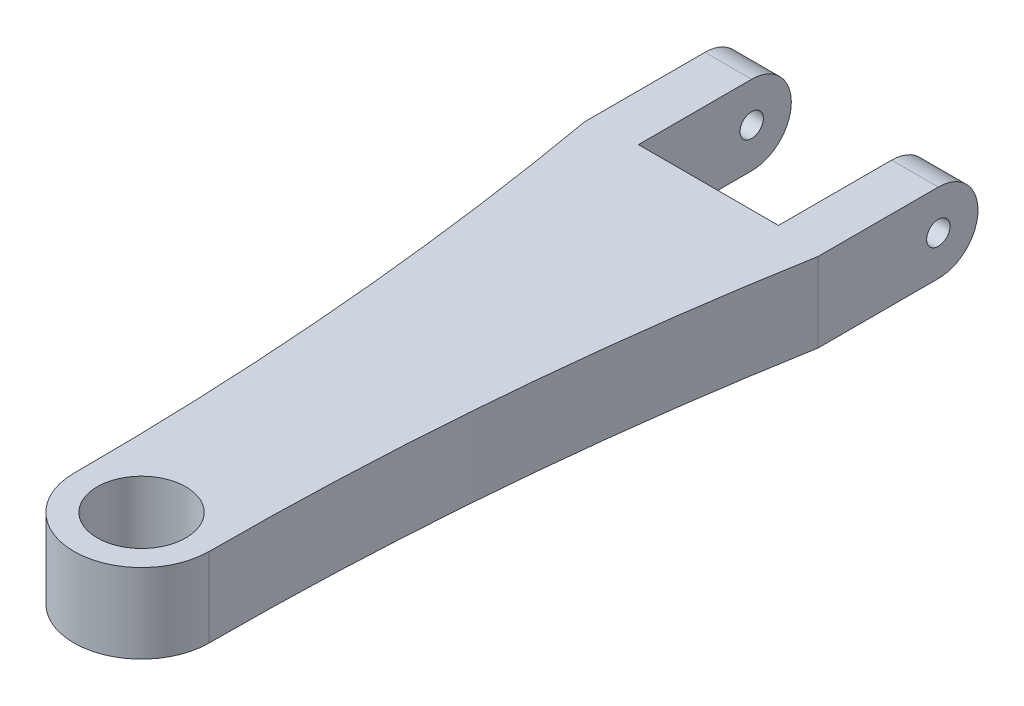
from build123d import *

# Parameters (mm, degrees)
SKETCH1_R               = 12.065
BOSS_EXTRUDE1_DEPTH     = 10.795
SKETCH5_W               = 38.1
SKETCH5_H               = 21.59
BOSS_EXTRUDE2_DEPTH     = 101.6
CUT_EXTRUDE1_REACH      = 261.255
SKETCH6_R               = 3.175
SKETCH4_W               = 12.7
SKETCH4_H               = 21.59
BOSS_EXTRUDE3_DEPTH     = 50.8
CUT_EXTRUDE2_DEPTH      = 210.73176208
CUT_EXTRUDE2_DEPTH_BACK = 210.73176208
SKETCH6_2_R             = 3.175
CUT_EXTRUDE3_DEPTH      = 214.164307578
CUT_EXTRUDE3_DEPTH_BACK = 214.164307578


with BuildPart() as part:
    # Sketch1 → Boss-Extrude1 (new, symmetric)
    with BuildSketch(Plane(origin=(0, 0, 0), x_dir=(1, 0, 0), z_dir=(0, 1, 0))):
        with BuildLine():
            Line((-31.75, 152.4), (31.75, 152.4))
            ThreePointArc((31.75, 152.4), (21.755106695, 76.491146914), (18.415, 0))
            ThreePointArc((18.415, 0), (0, -18.415), (-18.415, 0))
            ThreePointArc((-18.415, 0), (-21.755106695, 76.491146914), (-31.75, 152.4))
        make_face()
        Circle(SKETCH1_R, mode=Mode.SUBTRACT)
    extrude(amount=BOSS_EXTRUDE1_DEPTH, both=True)

    # Sketch5 → Boss-Extrude2 (add)
    with BuildSketch(Plane(origin=(0, 0, -152.4), x_dir=(-1, 0, 0), z_dir=(0, 0, -1))):
        Rectangle(SKETCH5_W, SKETCH5_H)
    extrude(amount=BOSS_EXTRUDE2_DEPTH)

    # Sketch6 → Cut-Extrude1 (cut, up to next)
    with BuildSketch(Plane(origin=(19.05, 0, 0), x_dir=(0, 0, -1), z_dir=(1, 0, 0)), mode=Mode.PRIVATE) as cut_extrude1_sk1:
        Polygon((152.4, -10.795), (154.288880246, 10.795), (254, 10.795), (254, -10.795), align=None)
        with Locations((185.094440123, 0)):
            Circle(SKETCH6_R, mode=Mode.SUBTRACT)
    cut_extrude1_tool1 = extrude(cut_extrude1_sk1.sketch, amount=-CUT_EXTRUDE1_REACH, mode=Mode.PRIVATE) & part.part
    add(cut_extrude1_tool1.solids().sort_by_distance((19.05, -0.034262, -203.945458))[0], mode=Mode.SUBTRACT)


with BuildPart() as cut_extrude1_piece_1:
    # of the separate pieces the step leaves, piece 1, a body of its own (cut_extrude1_pieces)
    add(part.part.solids().sort_by_distance((-31.75, -10.795, -152.4))[0])

    # Sketch4 → Boss-Extrude3 (add)
    with BuildSketch(Plane(origin=(0, 0, -152.4), x_dir=(-1, 0, 0), z_dir=(0, 0, -1))):
        with Locations((-25.4, 0)):
            Rectangle(SKETCH4_W, SKETCH4_H)
        with Locations((25.4, 0)):
            Rectangle(SKETCH4_W, SKETCH4_H)
    extrude(amount=BOSS_EXTRUDE3_DEPTH)


with BuildPart() as cut_extrude1_piece_2:
    # of the separate pieces the step leaves, piece 2, a body of its own (cut_extrude1_pieces)
    add(part.part.solids().sort_by_distance((-19.05, 0, -188.269440123))[0])


with BuildPart() as cut_extrude2_tool:
    # Sketch6<2> → Cut-Extrude2 (new, two sides: drawn at the far end of the back side and taken through both)
    with BuildSketch(Plane(origin=(19.05, 0, 0), x_dir=(0, 0, -1), z_dir=(1, 0, 0)).offset(-CUT_EXTRUDE2_DEPTH_BACK)):
        with Locations((185.094440123, 0)):
            Circle(SKETCH6_2_R)
    extrude(amount=CUT_EXTRUDE2_DEPTH + CUT_EXTRUDE2_DEPTH_BACK)


with BuildPart() as cut_extrude1_piece_1_1:
    add(cut_extrude1_piece_1.part)

    # Cut-Extrude2: cut by cut_extrude2_tool
    add(cut_extrude2_tool.part, mode=Mode.SUBTRACT)

    # Sketch7 → Cut-Extrude3 (cut, two sides: drawn at the far end of the back side and taken through both)
    with BuildSketch(Plane(origin=(31.75, 0, 0), x_dir=(0, 0, -1), z_dir=(1, 0, 0)).offset(-CUT_EXTRUDE3_DEPTH_BACK)):
        with BuildLine():
            Line((203.2, 10.795), (185.094440123, 10.795))
            ThreePointArc((185.094440123, 10.795), (192.727657826, 7.633217703), (195.889440123, 0))
            ThreePointArc((195.889440123, 0), (192.727657826, -7.633217703), (185.094440123, -10.795))
            Line((185.094440123, -10.795), (203.2, -10.795))
            Line((203.2, -10.795), (203.2, 10.795))
        make_face()
    extrude(amount=CUT_EXTRUDE3_DEPTH + CUT_EXTRUDE3_DEPTH_BACK, mode=Mode.SUBTRACT)


with BuildPart() as cut_extrude1_piece_2_1:
    add(cut_extrude1_piece_2.part)

    # Cut-Extrude2: cut by cut_extrude2_tool
    add(cut_extrude2_tool.part, mode=Mode.SUBTRACT)


solid = cut_extrude1_piece_1_1.part
